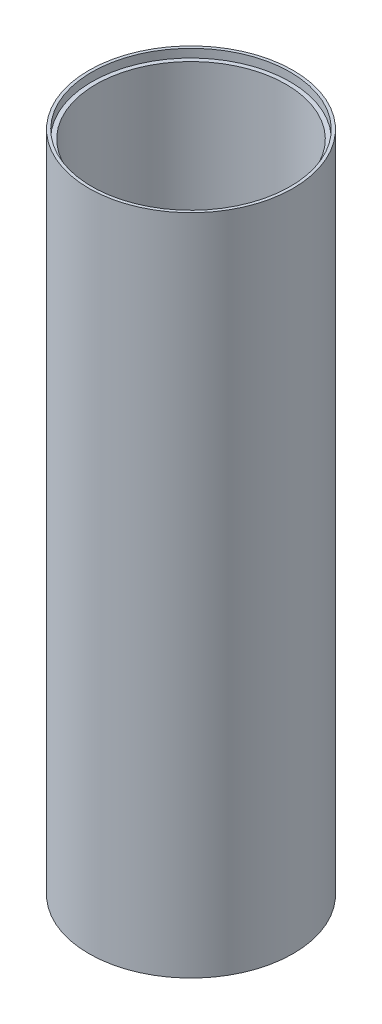
from build123d import *

# Parameters (mm, degrees)
SKETCH3_W          = 6.35
SKETCH3_H          = 6.35
CUT_EXTRUDE1_DEPTH = 198.872684098


with BuildPart() as part:
    # Sketch2 → Revolve1 (revolve)
    with BuildSketch(Plane.XY, mode=Mode.PRIVATE) as revolve1_sk:
        Polygon((0, 0), (-28.575, 0), (-28.575, 190.5), (-29.845, 190.5), (-29.845, 193.04), (-30.734, 193.04), (-30.734, -6.35), (0, -6.35), align=None)
    revolve(revolve1_sk.sketch.rotate(Axis((0, -6.35, 0), (0, 1, 0)), 270), axis=Axis((0, -6.35, 0), (0, 1, 0)))

    # Sketch3 → Cut-Extrude1 (cut, through all)
    with BuildSketch(Plane(origin=(0, 0, 0), x_dir=(1, 0, 0), z_dir=(0, 1, 0))):
        Rectangle(SKETCH3_W, SKETCH3_H)
    extrude(amount=-CUT_EXTRUDE1_DEPTH, mode=Mode.SUBTRACT)


solid = part.part
